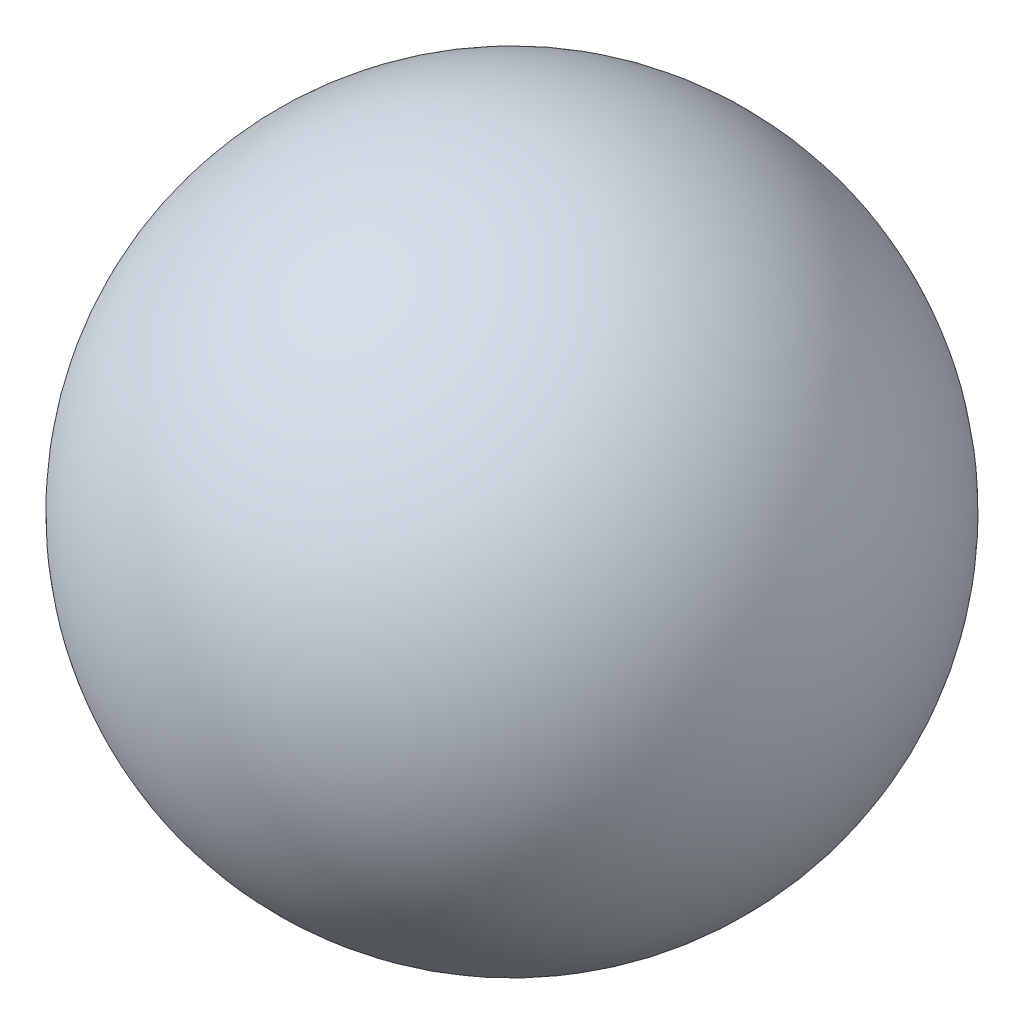
from build123d import *


with BuildPart() as part:
    # Sketch1 → Revolve1 (revolve)
    with BuildSketch(Plane(origin=(0, 0, 0), x_dir=(1, 0, 0), z_dir=(0, 1, 0))):
        with BuildLine():
            Line((0, 4), (0, -4))
            ThreePointArc((0, -4), (4, 0), (0, 4))
        make_face()
    revolve(axis=Axis((0, 0, -4), (0, 0, 1)))


solid = part.part
